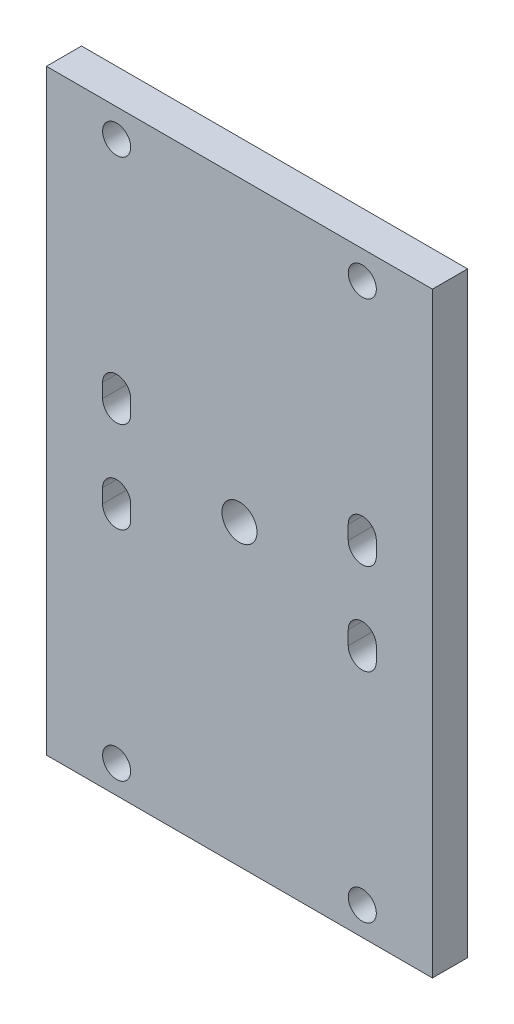
from build123d import *

# Parameters (mm, degrees)
ESQUISSE1_W        = 55
ESQUISSE1_H        = 85
BOSS_EXTRU_1_DEPTH = 5
SKETCH1_R          = 2
CUT_EXTRUDE1_DEPTH = 10
CUT_EXTRUDE2_START = -10
CUT_EXTRUDE2_DEPTH = 10
SKETCH3_R          = 2.5
CUT_EXTRUDE3_DEPTH = 10


with BuildPart() as part:
    # Esquisse1 → Boss.-Extru.1 (new body)
    with BuildSketch(Plane.XY):
        Rectangle(ESQUISSE1_W, ESQUISSE1_H)
    extrude(amount=BOSS_EXTRU_1_DEPTH)

    # Sketch1 → Cut-Extrude1 (cut)
    with BuildSketch(Plane.XY.offset(5)):
        with Locations((-17.5, 38.5)):
            Circle(SKETCH1_R)
        with Locations((-17.5, 7.5)):
            Circle(SKETCH1_R)
        with Locations(Location((17.5, 7.5, 0), (0, 0, 180))):
            Circle(SKETCH1_R)
        with Locations(Location((17.5, 38.5, 0), (0, 0, 180))):
            Circle(SKETCH1_R)
        with Locations((17.5, -38.5)):
            Circle(SKETCH1_R)
        with Locations((17.5, -7.5)):
            Circle(SKETCH1_R)
        with Locations(Location((-17.5, -7.5, 0), (0, 0, 180))):
            Circle(SKETCH1_R)
        with Locations(Location((-17.5, -38.5, 0), (0, 0, 180))):
            Circle(SKETCH1_R)
    extrude(amount=-CUT_EXTRUDE1_DEPTH, mode=Mode.SUBTRACT)

    # Sketch2 → Cut-Extrude2 (cut)
    with BuildSketch(Plane(origin=(0, 0, 0), x_dir=(-1, 0, 0), z_dir=(0, 0, -1)).offset(CUT_EXTRUDE2_START)):
        with BuildLine():
            Line((-19.5, 7.5), (-19.5, 5.5))
            ThreePointArc((-19.5, 5.5), (-17.5, 3.5), (-15.5, 5.5))
            Line((-15.5, 5.5), (-15.5, 7.5))
            ThreePointArc((-15.5, 7.5), (-17.5, 9.5), (-19.5, 7.5))
        make_face()
        with BuildLine():
            Line((15.5, 7.5), (15.5, 5.5))
            ThreePointArc((15.5, 5.5), (17.5, 3.5), (19.5, 5.5))
            Line((19.5, 5.5), (19.5, 7.5))
            ThreePointArc((19.5, 7.5), (17.5, 9.5), (15.5, 7.5))
        make_face()
        with BuildLine():
            Line((19.5, -7.5), (19.5, -5.5))
            ThreePointArc((19.5, -5.5), (17.5, -3.5), (15.5, -5.5))
            Line((15.5, -5.5), (15.5, -7.5))
            ThreePointArc((15.5, -7.5), (17.5, -9.5), (19.5, -7.5))
        make_face()
        with BuildLine():
            Line((-15.5, -7.5), (-15.5, -5.5))
            ThreePointArc((-15.5, -5.5), (-17.5, -3.5), (-19.5, -5.5))
            Line((-19.5, -5.5), (-19.5, -7.5))
            ThreePointArc((-19.5, -7.5), (-17.5, -9.5), (-15.5, -7.5))
        make_face()
    extrude(amount=CUT_EXTRUDE2_DEPTH, mode=Mode.SUBTRACT)

    # Sketch3 → Cut-Extrude3 (cut)
    with BuildSketch(Plane.XY.offset(5)):
        Circle(SKETCH3_R)
    extrude(amount=-CUT_EXTRUDE3_DEPTH, mode=Mode.SUBTRACT)


solid = part.part
